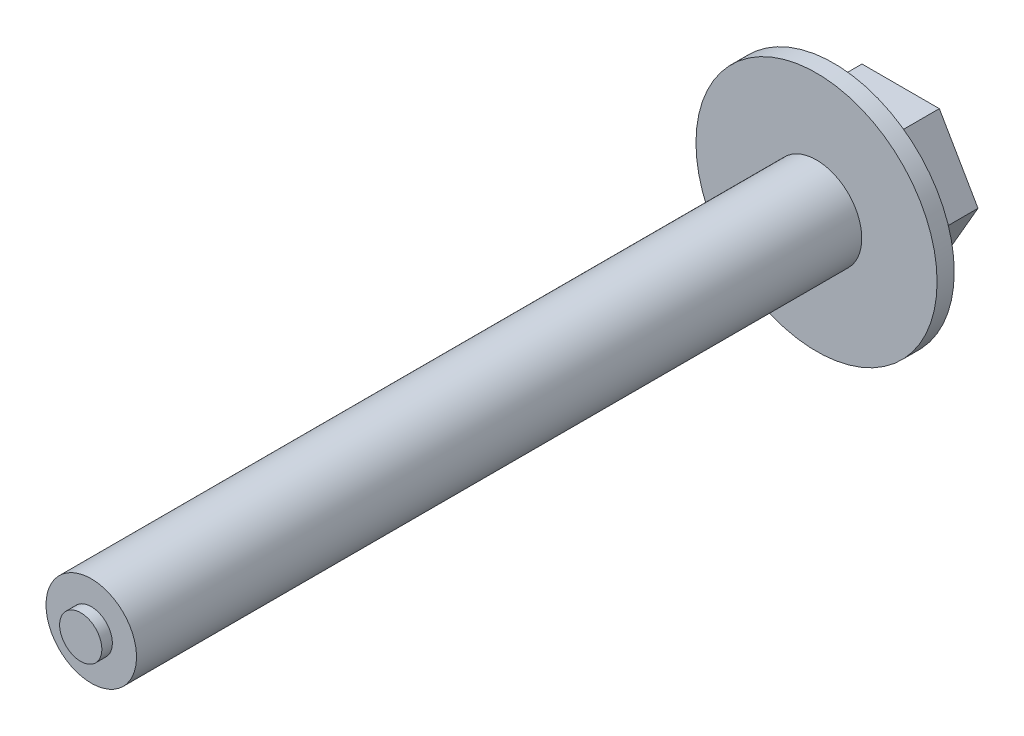
from build123d import *

# Parameters (mm, degrees)
BOSS_EXTRUDE1_DEPTH     = 3.175
SKETCH2_R               = 5.715
BOSS_EXTRUDE2_DEPTH     = 0.8128
CUT_EXTRUDE1_DEPTH      = 51.094096647
CUT_EXTRUDE1_DEPTH_BACK = 51.094096647
SKETCH4_W               = 11.07
SKETCH4_H               = 6


with BuildPart() as part:
    # Sketch1 → Boss-Extrude1 (new body)
    with BuildSketch(Plane.XY):
        Polygon((3.666174209, 0), (1.833087105, 3.175), (-1.833087105, 3.175), (-3.666174209, 0), (-1.833087105, -3.175), (1.833087105, -3.175), align=None)
    extrude(amount=BOSS_EXTRUDE1_DEPTH)

    # Sketch2 → Boss-Extrude2 (add)
    with BuildSketch(Plane.XY.offset(3.175)):
        Circle(SKETCH2_R)
    extrude(amount=BOSS_EXTRUDE2_DEPTH)

    # Sketch3 → Revolve1 (revolve)
    with BuildSketch(Plane(origin=(0, 0, 0), x_dir=(0, 0, -1), z_dir=(1, 0, 0)), mode=Mode.PRIVATE) as revolve1_sk:
        Polygon((-3.9878, 0), (-49.4378, 0), (-49.4378, 2.145), (-39.3678, 2.145), (-39.3678, 1), (-38.3678, 1), (-38.3678, 2.145), (-3.9878, 2.145), align=None)
    revolve(revolve1_sk.sketch.rotate(Axis((0, 0, 3.9878), (0, 0, 1)), 90), axis=Axis((0, 0, 3.9878), (0, 0, 1)))

    # Sketch4 → Cut-Extrude1 (cut, two sides: drawn at the far end of the back side and taken through both)
    with BuildSketch(Plane(origin=(0, 0, 0), x_dir=(0, 0, -1), z_dir=(1, 0, 0)).offset(-CUT_EXTRUDE1_DEPTH_BACK)):
        with Locations((-44.4028, 0)):
            Rectangle(SKETCH4_W, SKETCH4_H)
    extrude(amount=CUT_EXTRUDE1_DEPTH + CUT_EXTRUDE1_DEPTH_BACK, mode=Mode.SUBTRACT)


solid = part.part
